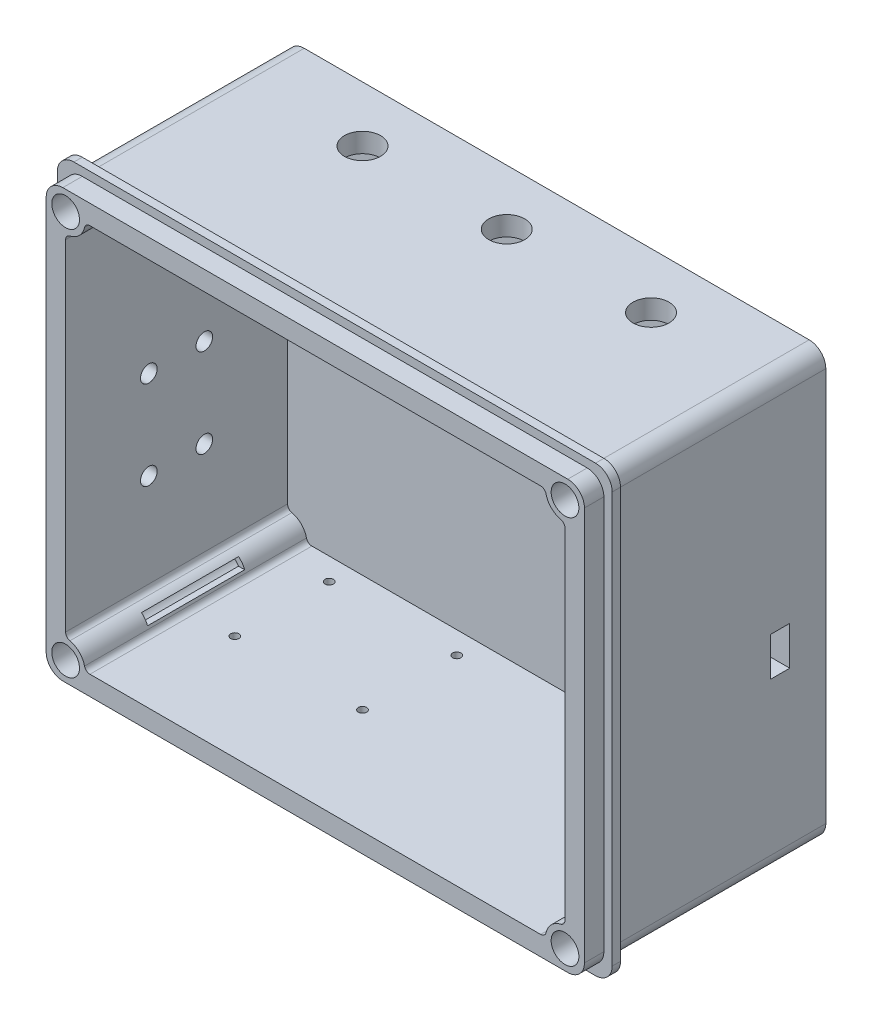
from build123d import *

# Parameters (mm, degrees)
ESQUISSE1_R             = 5
BOSS_EXTRU_1_DEPTH      = 7
BOSS_EXTRU_2_START      = 80
ESQUISSE1_4_R           = 5
BOSS_EXTRU_2_DEPTH      = 80
CONG_1_R                = 2
ESQUISSE2_R             = 1.5
ENL_V_MAT_EXTRU_1_DEPTH = 80
ESQUISSE4_R             = 6.5
ENL_V_MAT_EXTRU_2_DEPTH = 10
ESQUISSE5_W             = 7
ESQUISSE5_H             = 14
ENL_V_MAT_EXTRU_3_DEPTH = 10
ENL_V_MAT_EXTRU_4_REACH = 213.492
ESQUISSE6_W             = 35
ESQUISSE6_H             = 3
ENL_V_MAT_EXTRU_5_REACH = 190.173
ESQUISSE7_W             = 3
ESQUISSE7_H             = 35
ENL_V_MAT_EXTRU_6_DEPTH = 10
BOSS_EXTRU_3_START      = 73
BOSS_EXTRU_3_DEPTH      = 3
CONG_2_R                = 2
ESQUISSE11_R            = 3
ENL_V_MAT_EXTRU_7_DEPTH = 10


with BuildPart() as part:
    # Esquisse1 → Boss.-Extru.1 (new body)
    with BuildSketch(Plane.XY):
        with BuildLine():
            Line((-91, -77), (91, -77))
            ThreePointArc((91, -77), (95.242640687, -75.242640687), (97, -71))
            Line((97, -71), (97, 71))
            ThreePointArc((97, 71), (95.242640687, 75.242640687), (91, 77))
            Line((91, 77), (-91, 77))
            ThreePointArc((-91, 77), (-95.242640687, 75.242640687), (-97, 71))
            Line((-97, 71), (-97, -71))
            ThreePointArc((-97, -71), (-95.242640687, -75.242640687), (-91, -77))
        make_face()
        with Locations((90, -70)):
            Circle(ESQUISSE1_R, mode=Mode.SUBTRACT)
        with Locations((90, 70)):
            Circle(ESQUISSE1_R, mode=Mode.SUBTRACT)
        with Locations((-90, 70)):
            Circle(ESQUISSE1_R, mode=Mode.SUBTRACT)
        with Locations((-90, -70)):
            Circle(ESQUISSE1_R, mode=Mode.SUBTRACT)
    extrude(amount=-BOSS_EXTRU_1_DEPTH)

    # Esquisse1<4> → Boss.-Extru.2 (add)
    with BuildSketch(Plane.XY.offset(BOSS_EXTRU_2_START)):
        with BuildLine():
            ThreePointArc((-97, -71), (-95.242640687, -75.242640687), (-91, -77))
            Line((-91, -77), (91, -77))
            ThreePointArc((91, -77), (95.242640687, -75.242640687), (97, -71))
            Line((97, -71), (97, 71))
            ThreePointArc((97, 71), (95.242640687, 75.242640687), (91, 77))
            Line((91, 77), (-91, 77))
            ThreePointArc((-91, 77), (-95.242640687, 75.242640687), (-97, 71))
            Line((-97, 71), (-97, -71))
        make_face()
        with Locations((-90, -70)):
            Circle(ESQUISSE1_4_R, mode=Mode.SUBTRACT)
        with BuildLine():
            ThreePointArc((-83, -70), (-85.050252532, -65.050252532), (-90, -63))
            Line((-90, -63), (-90, 63))
            ThreePointArc((-90, 63), (-85.050252532, 65.050252532), (-83, 70))
            Line((-83, 70), (83, 70))
            ThreePointArc((83, 70), (85.050252532, 65.050252532), (90, 63))
            Line((90, 63), (90, -63))
            ThreePointArc((90, -63), (85.050252532, -65.050252532), (83, -70))
            Line((83, -70), (-83, -70))
        make_face(mode=Mode.SUBTRACT)
        with Locations((90, -70)):
            Circle(ESQUISSE1_4_R, mode=Mode.SUBTRACT)
        with Locations((90, 70)):
            Circle(ESQUISSE1_4_R, mode=Mode.SUBTRACT)
        with Locations((-90, 70)):
            Circle(ESQUISSE1_4_R, mode=Mode.SUBTRACT)
    extrude(amount=-BOSS_EXTRU_2_DEPTH)

    # Congé1
    cong_1_edges = [part.edges().sort_by_distance(p)[0] for p in [
        (-83, -70, 40),
        (-90, -63, 40),
        (-90, 63, 40),
        (-83, 70, 40),
        (83, 70, 40),
        (90, 63, 40),
        (90, -63, 40),
        (83, -70, 40),
    ]]
    fillet(cong_1_edges, radius=CONG_1_R)

    # Esquisse2 → Enlèv. mat.-Extru.1 (cut)
    with BuildSketch(Plane.XY):
        with Locations((66.5, 28.5)):
            Circle(ESQUISSE2_R)
        with Locations((66.5, 63.5)):
            Circle(ESQUISSE2_R)
        with Locations((41.5, 63.5)):
            Circle(ESQUISSE2_R)
        with Locations((41.5, 28.5)):
            Circle(ESQUISSE2_R)
        with Locations((-10.5, 28.5)):
            Circle(ESQUISSE2_R)
        with Locations((14.5, 28.5)):
            Circle(ESQUISSE2_R)
        with Locations((-10.5, 63.5)):
            Circle(ESQUISSE2_R)
        with Locations((14.5, 63.5)):
            Circle(ESQUISSE2_R)
        with Locations((-62.5, 28.5)):
            Circle(ESQUISSE2_R)
        with Locations((-37.5, 28.5)):
            Circle(ESQUISSE2_R)
        with Locations((-62.5, 63.5)):
            Circle(ESQUISSE2_R)
        with Locations((-37.5, 63.5)):
            Circle(ESQUISSE2_R)
        with Locations((52.5, 1.5)):
            Circle(ESQUISSE2_R)
        with Locations((83.5, 1.5)):
            Circle(ESQUISSE2_R)
        with Locations((52.5, -19.5)):
            Circle(ESQUISSE2_R)
        with Locations((83.5, -19.5)):
            Circle(ESQUISSE2_R)
    extrude(amount=-ENL_V_MAT_EXTRU_1_DEPTH, mode=Mode.SUBTRACT)

    # Esquisse4 → Enlèv. mat.-Extru.2 (cut)
    with BuildSketch(Plane(origin=(0, 77, 0), x_dir=(1, 0, 0), z_dir=(0, 1, 0))):
        with Locations(Location((-50, -13, 0), (0, 0, 270))):
            Circle(ESQUISSE4_R)
        with Locations(Location((2, -13, 0), (0, 0, 270))):
            Circle(ESQUISSE4_R)
        with Locations(Location((54, -13, 0), (0, 0, 270))):
            Circle(ESQUISSE4_R)
    extrude(amount=-ENL_V_MAT_EXTRU_2_DEPTH, mode=Mode.SUBTRACT)

    # Esquisse5 → Enlèv. mat.-Extru.3 (cut)
    with BuildSketch(Plane(origin=(97, 0, 0), x_dir=(0, 0, -1), z_dir=(1, 0, 0))):
        with Locations((-9.5, -9)):
            Rectangle(ESQUISSE5_W, ESQUISSE5_H)
    extrude(amount=-ENL_V_MAT_EXTRU_3_DEPTH, mode=Mode.SUBTRACT)

    # Enlèv. mat.-Extru.4: up to this face of the body (flat: up to its plane)
    enl_v_mat_extru_4_end = Plane(part.part.faces().sort_by_distance((-90, 0, 40))[0])
    # Esquisse6 → Enlèv. mat.-Extru.4 (cut, up to the picked face)
    with BuildSketch(Plane(origin=(-83, 0, 0), x_dir=(0, 0, -1), z_dir=(1, 0, 0)), mode=Mode.PRIVATE) as enl_v_mat_extru_4_sk1:
        with Locations((-39.5, 66)):
            Rectangle(ESQUISSE6_W, ESQUISSE6_H)
    enl_v_mat_extru_4_tool1 = split(extrude(enl_v_mat_extru_4_sk1.sketch, amount=-ENL_V_MAT_EXTRU_4_REACH, mode=Mode.PRIVATE), bisect_by=enl_v_mat_extru_4_end, keep=Keep.BOTH, mode=Mode.PRIVATE)
    # Esquisse6 → Enlèv. mat.-Extru.4 (cut, up to the picked face)
    with BuildSketch(Plane(origin=(-83, 0, 0), x_dir=(0, 0, -1), z_dir=(1, 0, 0)), mode=Mode.PRIVATE) as enl_v_mat_extru_4_sk2:
        with Locations((-39.5, -66)):
            Rectangle(ESQUISSE6_W, ESQUISSE6_H)
    enl_v_mat_extru_4_tool2 = split(extrude(enl_v_mat_extru_4_sk2.sketch, amount=-ENL_V_MAT_EXTRU_4_REACH, mode=Mode.PRIVATE), bisect_by=enl_v_mat_extru_4_end, keep=Keep.BOTH, mode=Mode.PRIVATE)
    add(enl_v_mat_extru_4_tool1.solids().sort_by(Axis((-83, 66, 39.5), (-1, 0, 0)))[0], mode=Mode.SUBTRACT)
    add(enl_v_mat_extru_4_tool2.solids().sort_by(Axis((-83, -66, 39.5), (-1, 0, 0)))[0], mode=Mode.SUBTRACT)

    # Enlèv. mat.-Extru.5: up to this face of the body (flat: up to its plane)
    enl_v_mat_extru_5_end = Plane(part.part.faces().sort_by_distance((0, -70, 40))[0])
    # Esquisse7 → Enlèv. mat.-Extru.5 (cut, up to the picked face)
    with BuildSketch(Plane(origin=(0, -63, 0), x_dir=(1, 0, 0), z_dir=(0, 1, 0)), mode=Mode.PRIVATE) as enl_v_mat_extru_5_sk1:
        with Locations((86, -39.5)):
            Rectangle(ESQUISSE7_W, ESQUISSE7_H)
    enl_v_mat_extru_5_tool1 = split(extrude(enl_v_mat_extru_5_sk1.sketch, amount=-ENL_V_MAT_EXTRU_5_REACH, mode=Mode.PRIVATE), bisect_by=enl_v_mat_extru_5_end, keep=Keep.BOTH, mode=Mode.PRIVATE)
    add(enl_v_mat_extru_5_tool1.solids().sort_by(Axis((86, -63, 39.5), (0, -1, 0)))[0], mode=Mode.SUBTRACT)

    # Esquisse8 → Enlèv. mat.-Extru.6 (cut)
    with BuildSketch(Plane(origin=(0, -70, 0), x_dir=(1, 0, 0), z_dir=(0, 1, 0))):
        with BuildLine():
            ThreePointArc((-65.5, -42), (-65.939339828, -40.939339828), (-67, -40.5))
            Line((-67, -40.5), (-67, -42))
            Line((-67, -42), (-65.5, -42))
        make_face()
        with BuildLine():
            Line((-67, -42), (-67, -40.5))
            ThreePointArc((-67, -40.5), (-68.060660172, -43.060660172), (-65.5, -42))
            Line((-65.5, -42), (-67, -42))
        make_face()
        with BuildLine():
            Line((-67, -9.5), (-67, -8))
            Line((-67, -8), (-65.5, -8))
            ThreePointArc((-65.5, -8), (-68.060660172, -6.939339828), (-67, -9.5))
        make_face()
        with BuildLine():
            Line((-65.5, -8), (-67, -8))
            Line((-67, -8), (-67, -9.5))
            ThreePointArc((-67, -9.5), (-65.939339828, -9.060660172), (-65.5, -8))
        make_face()
        with BuildLine():
            ThreePointArc((-19.5, -8), (-21, -6.5), (-22.5, -8))
            Line((-22.5, -8), (-21, -8))
            Line((-21, -8), (-21, -9.5))
            ThreePointArc((-21, -9.5), (-19.939339828, -9.060660172), (-19.5, -8))
        make_face()
        with BuildLine():
            Line((-21, -8), (-22.5, -8))
            ThreePointArc((-22.5, -8), (-22.060660172, -9.060660172), (-21, -9.5))
            Line((-21, -9.5), (-21, -8))
        make_face()
        with BuildLine():
            ThreePointArc((-19.5, -42), (-19.939339828, -40.939339828), (-21, -40.5))
            Line((-21, -40.5), (-21, -42))
            Line((-21, -42), (-22.5, -42))
            ThreePointArc((-22.5, -42), (-21, -43.5), (-19.5, -42))
        make_face()
        with BuildLine():
            Line((-21, -42), (-21, -40.5))
            ThreePointArc((-21, -40.5), (-22.060660172, -40.939339828), (-22.5, -42))
            Line((-22.5, -42), (-21, -42))
        make_face()
    extrude(amount=-ENL_V_MAT_EXTRU_6_DEPTH, mode=Mode.SUBTRACT)

    # Esquisse10 → Boss.-Extru.3 (add)
    with BuildSketch(Plane.XY.offset(BOSS_EXTRU_3_START)):
        with BuildLine():
            Line((-94, -80), (94, -80))
            ThreePointArc((94, -80), (98.242640687, -78.242640687), (100, -74))
            Line((100, -74), (100, 74))
            ThreePointArc((100, 74), (98.242640687, 78.242640687), (94, 80))
            Line((94, 80), (-94, 80))
            ThreePointArc((-94, 80), (-98.242640687, 78.242640687), (-100, 74))
            Line((-100, 74), (-100, -74))
            ThreePointArc((-100, -74), (-98.242640687, -78.242640687), (-94, -80))
        make_face()
        with BuildLine():
            Line((-91, -77), (91, -77))
            ThreePointArc((91, -77), (95.242640687, -75.242640687), (97, -71))
            Line((97, -71), (97, 71))
            ThreePointArc((97, 71), (95.242640687, 75.242640687), (91, 77))
            Line((91, 77), (-91, 77))
            ThreePointArc((-91, 77), (-95.242640687, 75.242640687), (-97, 71))
            Line((-97, 71), (-97, -71))
            ThreePointArc((-97, -71), (-95.242640687, -75.242640687), (-91, -77))
        make_face(mode=Mode.SUBTRACT)
    extrude(amount=-BOSS_EXTRU_3_DEPTH)

    # Congé2
    cong_2_edges = [part.edges().sort_by_distance(p)[0] for p in [
        (97, 0, 70),
        (95.242640687, 75.242640687, 70),
        (0, 77, 70),
        (-95.242640687, 75.242640687, 70),
        (-97, 0, 70),
        (-95.242640687, -75.242640687, 70),
        (0, -77, 70),
        (95.242640687, -75.242640687, 70),
    ]]
    fillet(cong_2_edges, radius=CONG_2_R)

    # Esquisse11 → Enlèv. mat.-Extru.7 (cut)
    with BuildSketch(Plane(origin=(-90, 0, 0), x_dir=(0, 0, -1), z_dir=(1, 0, 0))):
        with Locations((-50, -27.5)):
            Circle(ESQUISSE11_R)
        with Locations((-50, 4.5)):
            Circle(ESQUISSE11_R)
        with Locations((-30, 4.5)):
            Circle(ESQUISSE11_R)
        with Locations((-30, -27.5)):
            Circle(ESQUISSE11_R)
    extrude(amount=-ENL_V_MAT_EXTRU_7_DEPTH, mode=Mode.SUBTRACT)


solid = part.part
